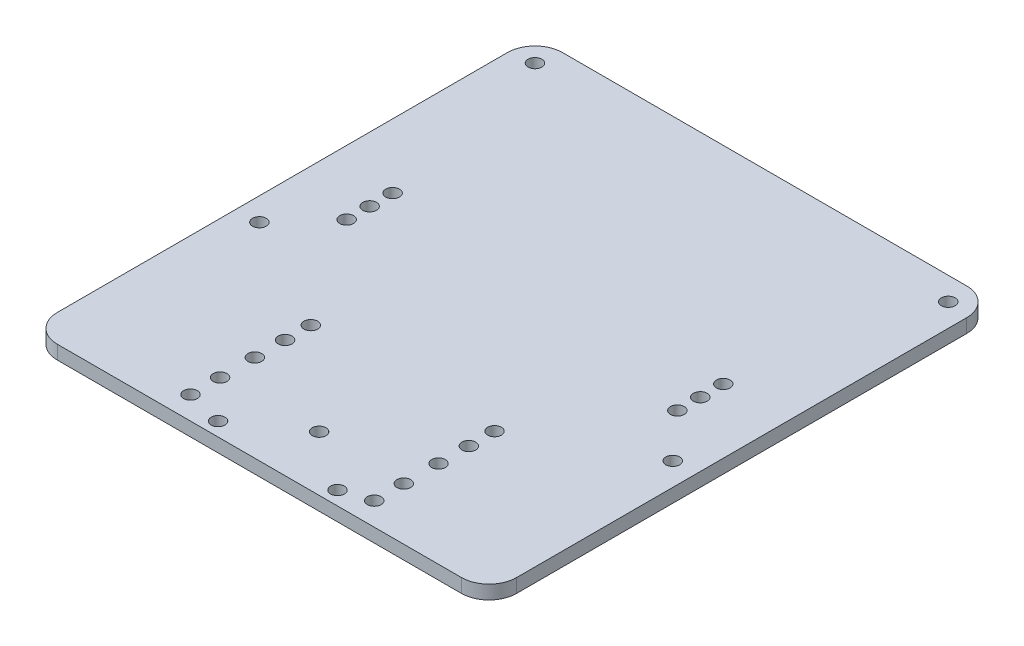
from build123d import *

# Parameters (mm, degrees)
SKETCH1_W           = 100
SKETCH1_H           = 70
BOSS_EXTRUDE1_DEPTH = 3
SKETCH2_R           = 1.5
CUT_EXTRUDE3_DEPTH  = 4
SKETCH3_W           = 50
SKETCH3_H           = 40
BOSS_EXTRUDE2_DEPTH = 3
CUT_EXTRUDE4_REACH  = 92.189
SKETCH4_R           = 1.5
SKETCH5_R           = 1.5
CUT_EXTRUDE5_DEPTH  = 3
CUT_EXTRUDE6_REACH  = 92.189
SKETCH6_R           = 1.5
CUT_EXTRUDE7_REACH  = 92.189
SKETCH8_R           = 1.5
SKETCH9_W           = 25
SKETCH9_H           = 40
SKETCH9_W_2         = 10.1139551
SKETCH9_H_2         = 8.275054173
BOSS_EXTRUDE3_DEPTH = 3
FILLET1_R           = 6


with BuildPart() as part:
    # Sketch1 → Boss-Extrude1 (new body)
    with BuildSketch(Plane(origin=(0, 0, 0), x_dir=(1, 0, 0), z_dir=(0, 1, 0))):
        Rectangle(SKETCH1_W, SKETCH1_H)
    extrude(amount=BOSS_EXTRUDE1_DEPTH)

    # Sketch2 → Cut-Extrude3 (cut)
    with BuildSketch(Plane(origin=(0, 0, 0), x_dir=(1, 0, 0), z_dir=(0, 1, 0))):
        with Locations(Location((-45, -30, 0), (0, 0, 270))):
            Circle(SKETCH2_R)
        with Locations(Location((45, -30, 0), (0, 0, 270))):
            Circle(SKETCH2_R)
        with Locations(Location((45, 30, 0), (0, 0, 270))):
            Circle(SKETCH2_R)
        with Locations(Location((-45, 30, 0), (0, 0, 270))):
            Circle(SKETCH2_R)
        with Locations(Location((-36, -20, 0), (0, 0, 270))):
            Circle(SKETCH2_R)
        with Locations(Location((36, -20, 0), (0, 0, 270))):
            Circle(SKETCH2_R)
        with Locations(Location((-36, -10, 0), (0, 0, 270))):
            Circle(SKETCH2_R)
        with Locations(Location((36, -10, 0), (0, 0, 270))):
            Circle(SKETCH2_R)
        with Locations(Location((-36, -15, 0), (0, 0, 270))):
            Circle(SKETCH2_R)
        with Locations(Location((36, -15, 0), (0, 0, 270))):
            Circle(SKETCH2_R)
    extrude(amount=CUT_EXTRUDE3_DEPTH, mode=Mode.SUBTRACT)

    # Sketch3 → Boss-Extrude2 (add)
    with BuildSketch(Plane(origin=(0, 0, 0), x_dir=(1, 0, 0), z_dir=(0, 1, 0))):
        with Locations((0, -55)):
            Rectangle(SKETCH3_W, SKETCH3_H)
    extrude(amount=BOSS_EXTRUDE2_DEPTH)

    # Sketch4 → Cut-Extrude4 (cut, up to next)
    with BuildSketch(Plane(origin=(0, 0, 0), x_dir=(1, 0, 0), z_dir=(0, 1, 0)), mode=Mode.PRIVATE) as cut_extrude4_sk1:
        with Locations(Location((-20, -70, 0), (0, 0, 90))):
            Circle(SKETCH4_R)
    cut_extrude4_tool1 = extrude(cut_extrude4_sk1.sketch, amount=CUT_EXTRUDE4_REACH, mode=Mode.PRIVATE) & part.part
    # Sketch4 → Cut-Extrude4 (cut, up to next)
    with BuildSketch(Plane(origin=(0, 0, 0), x_dir=(1, 0, 0), z_dir=(0, 1, 0)), mode=Mode.PRIVATE) as cut_extrude4_sk2:
        with Locations(Location((20, -70, 0), (0, 0, 90))):
            Circle(SKETCH4_R)
    cut_extrude4_tool2 = extrude(cut_extrude4_sk2.sketch, amount=CUT_EXTRUDE4_REACH, mode=Mode.PRIVATE) & part.part
    # Sketch4 → Cut-Extrude4 (cut, up to next)
    with BuildSketch(Plane(origin=(0, 0, 0), x_dir=(1, 0, 0), z_dir=(0, 1, 0)), mode=Mode.PRIVATE) as cut_extrude4_sk3:
        with Locations(Location((-20, -56, 0), (0, 0, 90))):
            Circle(SKETCH4_R)
    cut_extrude4_tool3 = extrude(cut_extrude4_sk3.sketch, amount=CUT_EXTRUDE4_REACH, mode=Mode.PRIVATE) & part.part
    # Sketch4 → Cut-Extrude4 (cut, up to next)
    with BuildSketch(Plane(origin=(0, 0, 0), x_dir=(1, 0, 0), z_dir=(0, 1, 0)), mode=Mode.PRIVATE) as cut_extrude4_sk4:
        with Locations(Location((20, -56, 0), (0, 0, 90))):
            Circle(SKETCH4_R)
    cut_extrude4_tool4 = extrude(cut_extrude4_sk4.sketch, amount=CUT_EXTRUDE4_REACH, mode=Mode.PRIVATE) & part.part
    # Sketch4 → Cut-Extrude4 (cut, up to next)
    with BuildSketch(Plane(origin=(0, 0, 0), x_dir=(1, 0, 0), z_dir=(0, 1, 0)), mode=Mode.PRIVATE) as cut_extrude4_sk5:
        with Locations(Location((1, -63, 0), (0, 0, 90))):
            Circle(SKETCH4_R)
    cut_extrude4_tool5 = extrude(cut_extrude4_sk5.sketch, amount=CUT_EXTRUDE4_REACH, mode=Mode.PRIVATE) & part.part
    add(cut_extrude4_tool1.solids().sort_by_distance((-20, 0, 70))[0], mode=Mode.SUBTRACT)
    add(cut_extrude4_tool2.solids().sort_by_distance((20, 0, 70))[0], mode=Mode.SUBTRACT)
    add(cut_extrude4_tool3.solids().sort_by_distance((-20, 0, 56))[0], mode=Mode.SUBTRACT)
    add(cut_extrude4_tool4.solids().sort_by_distance((20, 0, 56))[0], mode=Mode.SUBTRACT)
    add(cut_extrude4_tool5.solids().sort_by_distance((1, 0, 63))[0], mode=Mode.SUBTRACT)

    # Sketch5 → Cut-Extrude5 (cut)
    with BuildSketch(Plane.XZ):
        with Locations((68.9999632, 26.624996827)):
            Circle(SKETCH5_R)
    extrude(amount=-CUT_EXTRUDE5_DEPTH, mode=Mode.SUBTRACT)

    # Sketch6 → Cut-Extrude6 (cut, up to next)
    with BuildSketch(Plane.XZ, mode=Mode.PRIVATE) as cut_extrude6_sk1:
        with Locations(Location((-20, 63.563183916, 0), (0, 0, 270))):
            Circle(SKETCH6_R)
    cut_extrude6_tool1 = extrude(cut_extrude6_sk1.sketch, amount=-CUT_EXTRUDE6_REACH, mode=Mode.PRIVATE) & part.part
    # Sketch6 → Cut-Extrude6 (cut, up to next)
    with BuildSketch(Plane.XZ, mode=Mode.PRIVATE) as cut_extrude6_sk2:
        with Locations(Location((20, 63.563183916, 0), (0, 0, 270))):
            Circle(SKETCH6_R)
    cut_extrude6_tool2 = extrude(cut_extrude6_sk2.sketch, amount=-CUT_EXTRUDE6_REACH, mode=Mode.PRIVATE) & part.part
    # Sketch6 → Cut-Extrude6 (cut, up to next)
    with BuildSketch(Plane.XZ, mode=Mode.PRIVATE) as cut_extrude6_sk3:
        with Locations(Location((20, 43.808225194, 0), (0, 0, 270))):
            Circle(SKETCH6_R)
    cut_extrude6_tool3 = extrude(cut_extrude6_sk3.sketch, amount=-CUT_EXTRUDE6_REACH, mode=Mode.PRIVATE) & part.part
    # Sketch6 → Cut-Extrude6 (cut, up to next)
    with BuildSketch(Plane.XZ, mode=Mode.PRIVATE) as cut_extrude6_sk4:
        with Locations(Location((-20, 49.40580256, 0), (0, 0, 270))):
            Circle(SKETCH6_R)
    cut_extrude6_tool4 = extrude(cut_extrude6_sk4.sketch, amount=-CUT_EXTRUDE6_REACH, mode=Mode.PRIVATE) & part.part
    # Sketch6 → Cut-Extrude6 (cut, up to next)
    with BuildSketch(Plane.XZ, mode=Mode.PRIVATE) as cut_extrude6_sk5:
        with Locations(Location((-20, 43.808225194, 0), (0, 0, 270))):
            Circle(SKETCH6_R)
    cut_extrude6_tool5 = extrude(cut_extrude6_sk5.sketch, amount=-CUT_EXTRUDE6_REACH, mode=Mode.PRIVATE) & part.part
    # Sketch6 → Cut-Extrude6 (cut, up to next)
    with BuildSketch(Plane.XZ, mode=Mode.PRIVATE) as cut_extrude6_sk6:
        with Locations(Location((20, 49.40580256, 0), (0, 0, 270))):
            Circle(SKETCH6_R)
    cut_extrude6_tool6 = extrude(cut_extrude6_sk6.sketch, amount=-CUT_EXTRUDE6_REACH, mode=Mode.PRIVATE) & part.part
    add(cut_extrude6_tool1.solids().sort_by_distance((-20, 0, 63.563184))[0], mode=Mode.SUBTRACT)
    add(cut_extrude6_tool2.solids().sort_by_distance((20, 0, 63.563184))[0], mode=Mode.SUBTRACT)
    add(cut_extrude6_tool3.solids().sort_by_distance((20, 0, 43.808225))[0], mode=Mode.SUBTRACT)
    add(cut_extrude6_tool4.solids().sort_by_distance((-20, 0, 49.405803))[0], mode=Mode.SUBTRACT)
    add(cut_extrude6_tool5.solids().sort_by_distance((-20, 0, 43.808225))[0], mode=Mode.SUBTRACT)
    add(cut_extrude6_tool6.solids().sort_by_distance((20, 0, 49.405803))[0], mode=Mode.SUBTRACT)

    # Sketch8 → Cut-Extrude7 (cut, up to next)
    with BuildSketch(Plane(origin=(0, 0, 0), x_dir=(1, 0, 0), z_dir=(0, 1, 0)), mode=Mode.PRIVATE) as cut_extrude7_sk1:
        with Locations(Location((-12, -72, 0), (0, 0, 90))):
            Circle(SKETCH8_R)
    cut_extrude7_tool1 = extrude(cut_extrude7_sk1.sketch, amount=CUT_EXTRUDE7_REACH, mode=Mode.PRIVATE) & part.part
    # Sketch8 → Cut-Extrude7 (cut, up to next)
    with BuildSketch(Plane(origin=(0, 0, 0), x_dir=(1, 0, 0), z_dir=(0, 1, 0)), mode=Mode.PRIVATE) as cut_extrude7_sk2:
        with Locations(Location((14, -72, 0), (0, 0, 90))):
            Circle(SKETCH8_R)
    cut_extrude7_tool2 = extrude(cut_extrude7_sk2.sketch, amount=CUT_EXTRUDE7_REACH, mode=Mode.PRIVATE) & part.part
    add(cut_extrude7_tool1.solids().sort_by_distance((-12, 0, 72))[0], mode=Mode.SUBTRACT)
    add(cut_extrude7_tool2.solids().sort_by_distance((14, 0, 72))[0], mode=Mode.SUBTRACT)

    # Sketch9 → Boss-Extrude3 (add)
    with BuildSketch(Plane(origin=(0, 0, 0), x_dir=(1, 0, 0), z_dir=(0, 1, 0))):
        with Locations((37.5, -55)):
            Rectangle(SKETCH9_W, SKETCH9_H)
        with Locations((-37.5, -55)):
            Rectangle(SKETCH9_W, SKETCH9_H)
        with Locations((36.349588901, -26.811598528)):
            Rectangle(SKETCH9_W_2, SKETCH9_H_2)
    extrude(amount=BOSS_EXTRUDE3_DEPTH)

    # Fillet1
    fillet1_edges = [part.edges().sort_by_distance(p)[0] for p in [
        (50, 1.5, 75),
        (-50, 1.5, 75),
        (-50, 1.5, -35),
        (50, 1.5, -35),
    ]]
    fillet(fillet1_edges, radius=FILLET1_R)


solid = part.part
